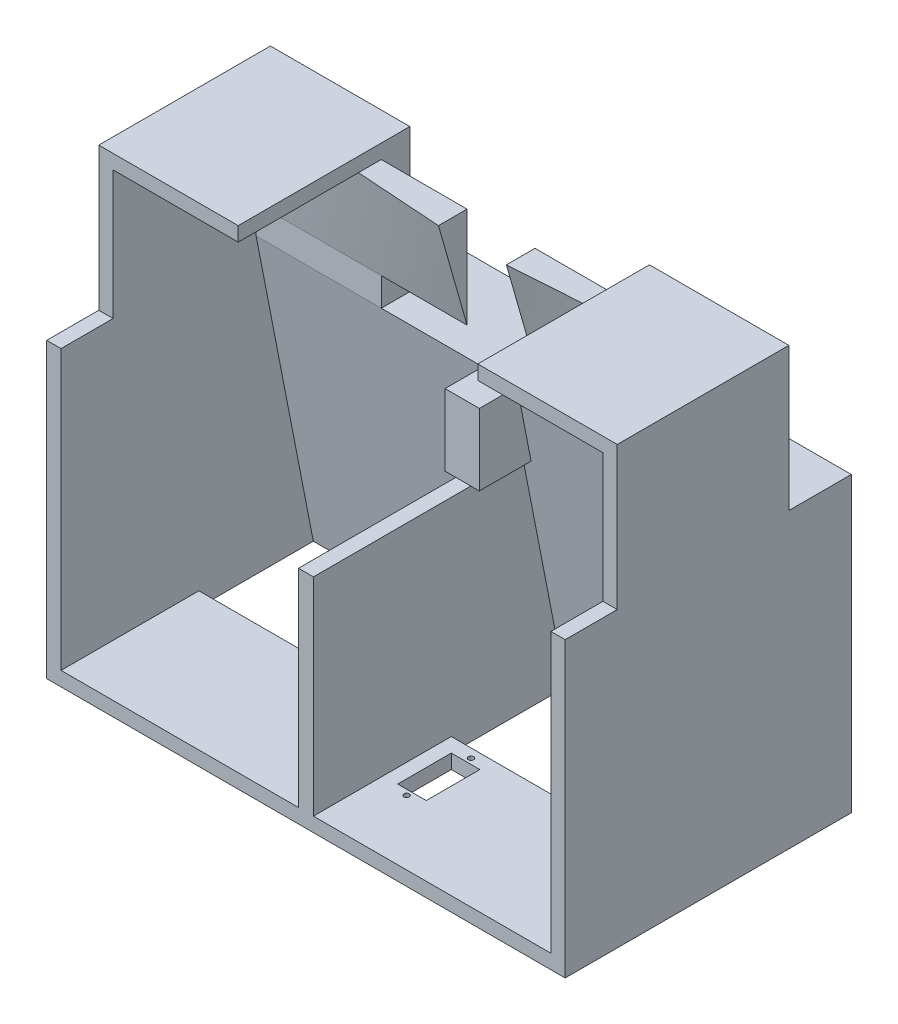
from build123d import *

# Parameters (mm, degrees)
SKETCH1_W            = 230.16
SKETCH1_H            = 130.080000074
BOSS_EXTRUDE1_DEPTH  = 15
SKETCH2_R            = 3.175
CUT_EXTRUDE1_DEPTH   = 10
BOSS_EXTRUDE2_DEPTH  = 230.16
SKETCH5_W            = 6.35
SKETCH5_H            = 130.080000074
SKETCH5_W_2          = 6.64
BOSS_EXTRUDE3_DEPTH  = 127
SKETCH6_W            = 55.554601445
SKETCH6_H            = 12.7
SKETCH6_W_2          = 55.555398555
BOSS_EXTRUDE4_DEPTH  = 57.15
SKETCH17_W           = 6.35
SKETCH17_H           = 57.15
BOSS_EXTRUDE9_DEPTH  = 76.2
SKETCH18_W           = 15.24
SKETCH18_H           = 31.75
CUT_EXTRUDE2_DEPTH   = 69.85
SKETCH19_W           = 3.81
SKETCH19_H           = 31.75
SKETCH19_W_2         = 4.79
BOSS_EXTRUDE10_DEPTH = 25.4
SKETCH20_W           = 230.16
SKETCH20_H           = 61.2
BOSS_EXTRUDE12_DEPTH = 6.35
SKETCH21_R           = 1.190625
SKETCH21_W           = 12.7
SKETCH21_H           = 23.8125
CUT_EXTRUDE3_DEPTH   = 6.35


with BuildPart() as part:
    # Sketch1 → Boss-Extrude1 (new body)
    with BuildSketch(Plane.XY):
        with Locations((0, -10.039999963)):
            Rectangle(SKETCH1_W, SKETCH1_H)
    extrude(amount=BOSS_EXTRUDE1_DEPTH)

    # Sketch2 → Cut-Extrude1 (cut)
    with BuildSketch(Plane(origin=(0, 0, 0), x_dir=(-1, 0, 0), z_dir=(0, 0, -1))):
        with Locations((60, -70)):
            Circle(SKETCH2_R)
        with Locations((50, -70)):
            Circle(SKETCH2_R)
        with Locations((40, -70)):
            Circle(SKETCH2_R)
        with Locations((-40, -70)):
            Circle(SKETCH2_R)
        with Locations((-50, -70)):
            Circle(SKETCH2_R)
        with Locations((-60, -70)):
            Circle(SKETCH2_R)
        with Locations((-110, 10)):
            Circle(SKETCH2_R)
        with Locations((-110, 20)):
            Circle(SKETCH2_R)
        with Locations((-110, 30)):
            Circle(SKETCH2_R)
        with Locations((110, 10)):
            Circle(SKETCH2_R)
        with Locations((110, 20)):
            Circle(SKETCH2_R)
        with Locations((110, 30)):
            Circle(SKETCH2_R)
    extrude(amount=-CUT_EXTRUDE1_DEPTH, mode=Mode.SUBTRACT)

    # Sketch4 → Boss-Extrude2 (add)
    with BuildSketch(Plane.ZY.offset(115.08)):
        Polygon((15, -75.08), (15, 55.000000074), (40.4, 55.000000074), align=None)
    extrude(amount=-BOSS_EXTRUDE2_DEPTH)

    # Sketch5 → Boss-Extrude3 (add)
    with BuildSketch(Plane(origin=(0, 0, 0), x_dir=(-1, 0, 0), z_dir=(0, 0, -1))):
        with Locations((111.905, -10.039999963)):
            Rectangle(SKETCH5_W, SKETCH5_H)
        with Locations((-111.905, -10.039999963)):
            Rectangle(SKETCH5_W, SKETCH5_H)
        with Locations((0, -10.039999963)):
            Rectangle(SKETCH5_W_2, SKETCH5_H)
    extrude(amount=-BOSS_EXTRUDE3_DEPTH)

    # Sketch6 → Boss-Extrude4 (add)
    with BuildSketch(Plane(origin=(0, 55.000000074, 0), x_dir=(1, 0, 0), z_dir=(0, 1, 0))):
        with Locations((-80.952699278, -34.05)):
            Rectangle(SKETCH6_W, SKETCH6_H)
        with Locations((80.952300722, -34.05)):
            Rectangle(SKETCH6_W_2, SKETCH6_H)
    extrude(amount=BOSS_EXTRUDE4_DEPTH)

    # Sketch14 → Loft1 section 0
    with BuildSketch(Plane.ZY.offset(108.73)):
        with BuildLine():
            Line((40.4, 67.540000074), (40.4, 112.150000074))
            Line((40.4, 112.150000074), (46.75, 112.150000074))
            Line((46.75, 112.150000074), (40.4, 67.540000074))
        make_face()
    # Sketch13 → Loft1 section 1
    with BuildSketch(Plane(origin=(-15.075398555, 0, 0), x_dir=(0, 0, -1), z_dir=(1, 0, 0))):
        with BuildLine():
            Line((-40.4, 112.150000074), (-40.4, 67.540000074))
            Line((-40.4, 67.540000074), (-53.1, 112.150000074))
            Line((-53.1, 112.150000074), (-40.4, 112.150000074))
        make_face()
    loft()

    # Sketch15 → Loft2 section 0
    with BuildSketch(Plane.ZY.offset(-15.074601445)):
        with BuildLine():
            Line((53.1, 112.150000074), (40.4, 67.540000074))
            Line((40.4, 67.540000074), (40.4, 112.150000074))
            Line((40.4, 112.150000074), (53.1, 112.150000074))
        make_face()
    # Sketch16 → Loft2 section 1
    with BuildSketch(Plane(origin=(108.73, 0, 0), x_dir=(0, 0, -1), z_dir=(1, 0, 0))):
        with BuildLine():
            Line((-40.4, 112.150000074), (-46.75, 112.150000074))
            Line((-46.75, 112.150000074), (-40.4, 67.540000074))
            Line((-40.4, 67.540000074), (-40.4, 112.150000074))
        make_face()
    loft()

    # Sketch17 → Boss-Extrude9 (add)
    with BuildSketch(Plane(origin=(0, 0, 27.7), x_dir=(-1, 0, 0), z_dir=(0, 0, -1))):
        Polygon((-115.08, 112.150000074), (-108.73, 112.150000074), (-53.174601445, 112.150000074), (-53.174601445, 118.500000074), (-115.08, 118.500000074), align=None)
        with Locations((-111.905, 83.575000074)):
            Rectangle(SKETCH17_W, SKETCH17_H)
        Polygon((108.73, 112.150000074), (115.08, 112.150000074), (115.08, 118.500000074), (53.175398555, 118.500000074), (53.175398555, 112.150000074), align=None)
        with Locations((111.905, 83.575000074)):
            Rectangle(SKETCH17_W, SKETCH17_H)
    extrude(amount=-BOSS_EXTRUDE9_DEPTH)

    # Sketch18 → Cut-Extrude2 (cut)
    with BuildSketch(Plane.XY.offset(127)):
        with Locations((-0.33125, 39.125000074)):
            Rectangle(SKETCH18_W, SKETCH18_H)
    extrude(amount=-CUT_EXTRUDE2_DEPTH, mode=Mode.SUBTRACT)

    # Sketch19 → Boss-Extrude10 (add)
    with BuildSketch(Plane.XY.offset(57.15)):
        with Locations((5.225, 39.125000074)):
            Rectangle(SKETCH19_W, SKETCH19_H)
        with Locations((-5.715, 39.125000074)):
            Rectangle(SKETCH19_W_2, SKETCH19_H)
    extrude(amount=-BOSS_EXTRUDE10_DEPTH)

    # Sketch20 → Boss-Extrude12 (add)
    with BuildSketch(Plane.XZ.offset(75.08)):
        with Locations((0, 96.4)):
            Rectangle(SKETCH20_W, SKETCH20_H)
    extrude(amount=-BOSS_EXTRUDE12_DEPTH)

    # Sketch21 → Cut-Extrude3 (cut)
    with BuildSketch(Plane.XZ.offset(75.08)):
        with Locations(Location((-16.02, 69.76875, 0), (0, 0, 270))):
            Circle(SKETCH21_R)
        with Locations(Location((-16.02, 98.34375, 0), (0, 0, 270))):
            Circle(SKETCH21_R)
        with Locations(Location((16.02, 69.76875, 0), (0, 0, 270))):
            Circle(SKETCH21_R)
        with Locations(Location((16.02, 98.34375, 0), (0, 0, 270))):
            Circle(SKETCH21_R)
        with Locations((-16.02, 84.05625)):
            Rectangle(SKETCH21_W, SKETCH21_H)
        with Locations((16.02, 84.05625)):
            Rectangle(SKETCH21_W, SKETCH21_H)
    extrude(amount=-CUT_EXTRUDE3_DEPTH, mode=Mode.SUBTRACT)


solid = part.part
